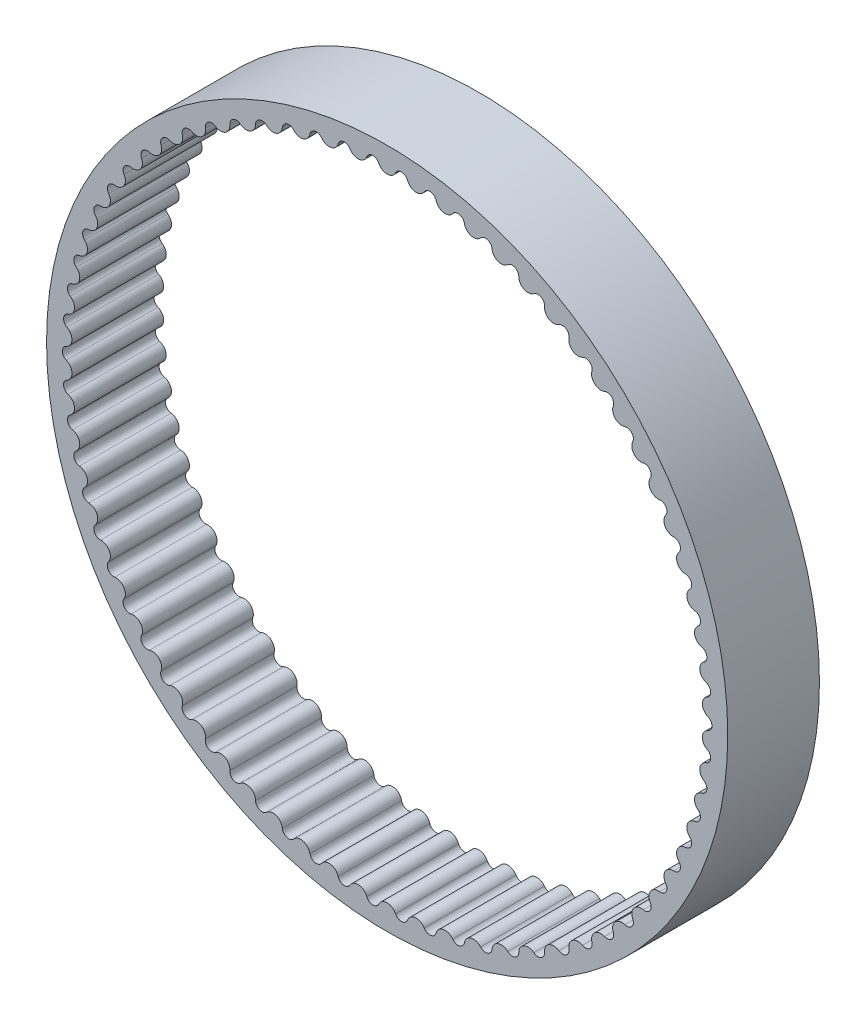
from build123d import *

# Parameters (mm, degrees)
SKETCH2_R           = 22.281710853
SKETCH2_R_2         = 20.641710853
BOSS_EXTRUDE1_DEPTH = 3
CUT_EXTRUDE1_DEPTH  = 32.653582374
CIRPATTERN3_COUNT   = 70


with BuildPart() as part:
    # Sketch2 → Boss-Extrude1 (new, symmetric)
    with BuildSketch(Plane.XY):
        Circle(SKETCH2_R)
        Circle(SKETCH2_R_2, mode=Mode.SUBTRACT)
    extrude(amount=BOSS_EXTRUDE1_DEPTH, both=True)

    # Sketch3 → Cut-Extrude1 (cut, symmetric)
    with BuildSketch(Plane.XY):
        with BuildLine():
            ThreePointArc((1.850308695, 20.558613394), (0.926086856, 20.620926024), (0, 20.641710853))
            ThreePointArc((0, 20.641710853), (0.325304148, 20.7356903), (0.550372545, 20.988670816))
            ThreePointArc((0.550372545, 20.988670816), (0.953454402, 21.230311795), (1.333253039, 20.953511613))
            ThreePointArc((1.333253039, 20.953511613), (1.534738379, 20.681374546), (1.850308695, 20.558613394))
        make_face()
    cut_extrude1 = extrude(amount=CUT_EXTRUDE1_DEPTH, both=True, mode=Mode.SUBTRACT)

    # CirPattern3: Cut-Extrude1 ×70 about axis
    cirpattern3_axis = Axis((0, 0, 3), (0, 0, -1))
    for i in range(1, CIRPATTERN3_COUNT):
        add(cut_extrude1.rotate(cirpattern3_axis, i * 360 / CIRPATTERN3_COUNT), mode=Mode.SUBTRACT)


solid = part.part
